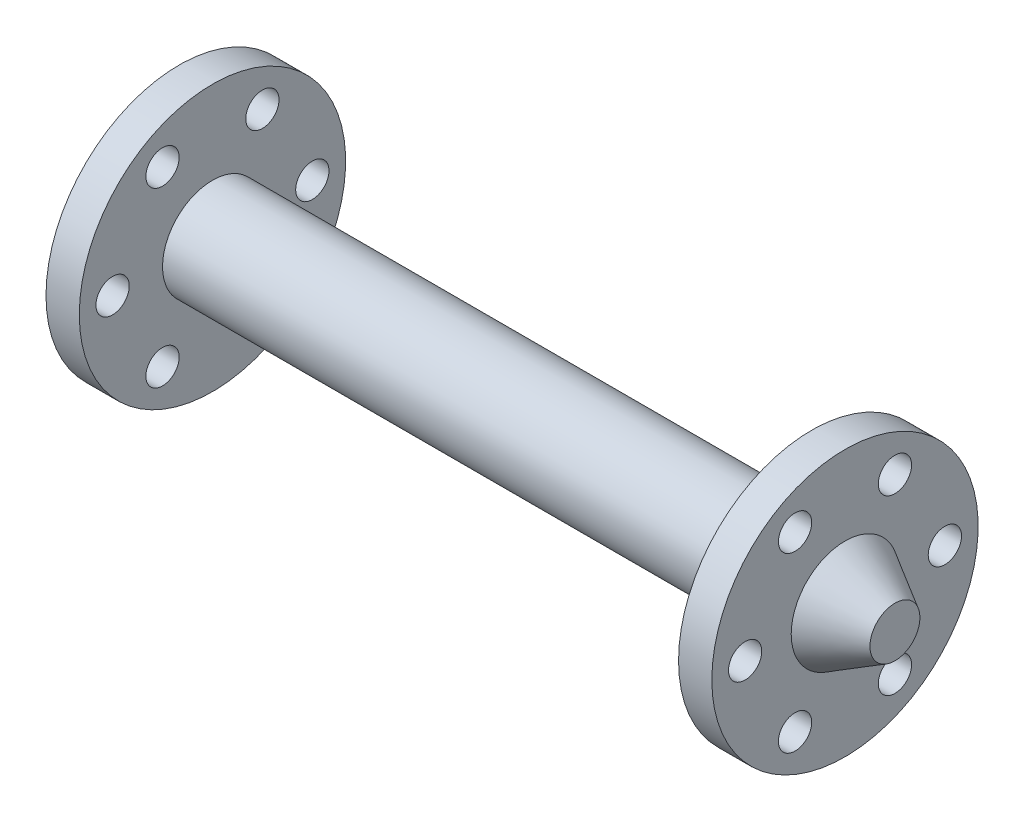
from build123d import *

# Parameters (mm, degrees)
SKETCH2_R          = 10
CUT_EXTRUDE1_DEPTH = 529


with BuildPart() as part:
    # Sketch1 → Revolve1 (revolve)
    with BuildSketch(Plane.XY, mode=Mode.PRIVATE) as revolve1_sk:
        Polygon((179.996233933, -30), (179.996233933, -80), (199.996233933, -80), (199.996233933, -32.322682415), (230, -15), (230, 0), (-230, 0), (-230, -15), (-199.996233933, -32.322682415), (-199.996233933, -80), (-179.996233933, -80), (-179.996233933, -30), align=None)
    revolve(revolve1_sk.sketch.rotate(Axis((-230, 0, 0), (1, 0, 0)), 270), axis=Axis((-230, 0, 0), (1, 0, 0)))

    # Sketch2 → Cut-Extrude1 (cut)
    with BuildSketch(Plane.ZY.offset(199.996233933)):
        with Locations((-60, 0)):
            Circle(SKETCH2_R)
        with Locations((-30, 51.961524227)):
            Circle(SKETCH2_R)
        with Locations((30, 51.961524227)):
            Circle(SKETCH2_R)
        with Locations((60, 0)):
            Circle(SKETCH2_R)
        with Locations((30, -51.961524227)):
            Circle(SKETCH2_R)
        with Locations((-30, -51.961524227)):
            Circle(SKETCH2_R)
    extrude(amount=-CUT_EXTRUDE1_DEPTH, mode=Mode.SUBTRACT)


solid = part.part
